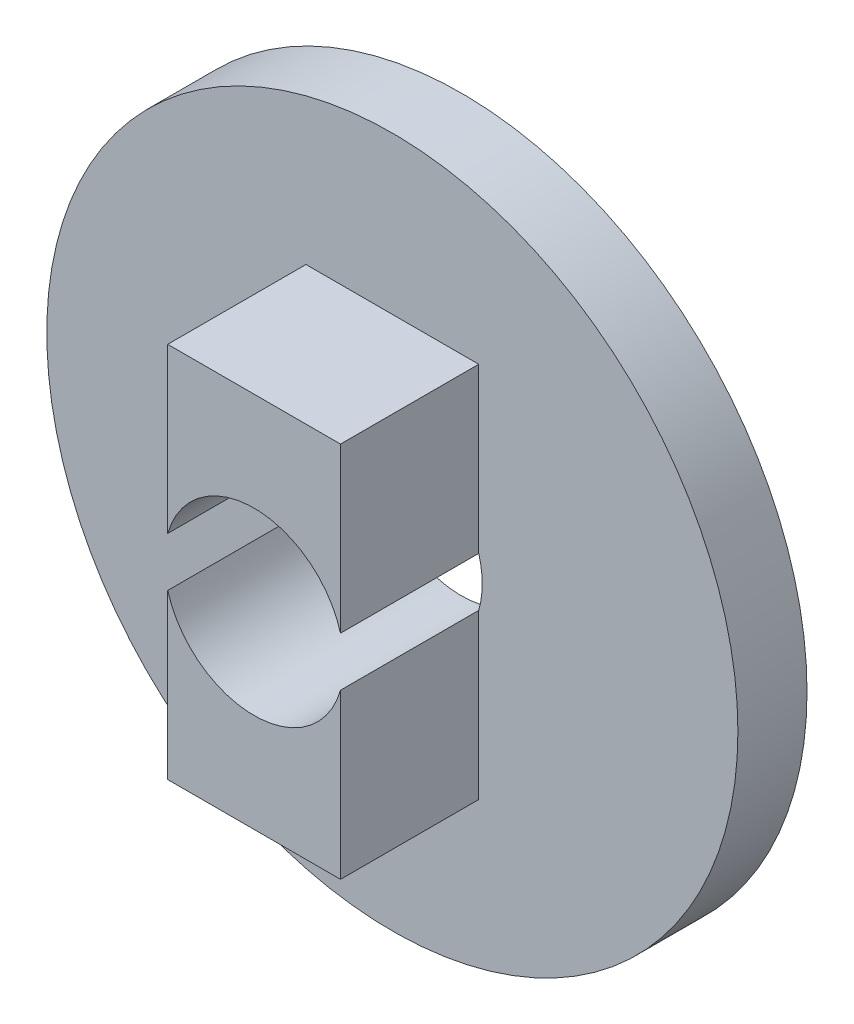
from build123d import *

# Parameters (mm, degrees)
SKETCH1_R                      = 5
BOSS_EXTRUDE1_DEPTH            = 1
SKETCH2_W                      = 2.5
SKETCH2_H                      = 5.454356058
BOSS_EXTRUDE2_DEPTH            = 2
F_2_6_2_6_DIAMETER_HOLE1_D     = 2.6
F_2_6_2_6_DIAMETER_HOLE1_DEPTH = 9
F_2_6_2_6_DIAMETER_HOLE1_TIP   = 0.781118805


with BuildPart() as part:
    # Sketch1 → Boss-Extrude1 (new body)
    with BuildSketch(Plane.XY):
        Circle(SKETCH1_R)
    extrude(amount=BOSS_EXTRUDE1_DEPTH)

    # Sketch2 → Boss-Extrude2 (add)
    with BuildSketch(Plane.XY.offset(1)):
        Rectangle(SKETCH2_W, SKETCH2_H)
    extrude(amount=BOSS_EXTRUDE2_DEPTH)

    # Ø2.6 (2.6) Diameter Hole1
    with Locations(Plane.XY.offset(3)):
        with Locations((0, 0)):
            Hole(F_2_6_2_6_DIAMETER_HOLE1_D / 2, depth=F_2_6_2_6_DIAMETER_HOLE1_DEPTH)
            with Locations((0, 0, -(F_2_6_2_6_DIAMETER_HOLE1_DEPTH + F_2_6_2_6_DIAMETER_HOLE1_TIP / 2))):  # 118° drill point
                Cone(0, F_2_6_2_6_DIAMETER_HOLE1_D / 2, F_2_6_2_6_DIAMETER_HOLE1_TIP, mode=Mode.SUBTRACT)


solid = part.part
